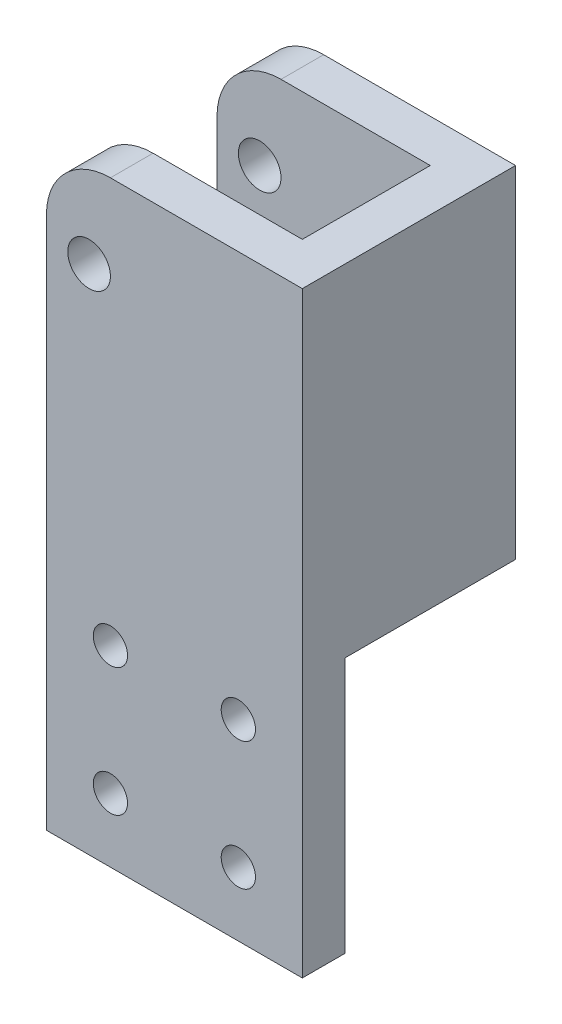
from build123d import *

# Parameters (mm, degrees)
SKETCH1_W                   = 38.1
SKETCH1_H                   = 76.2
BOSS_EXTRUDE1_DEPTH         = 31.75
SKETCH3_W                   = 25.4
SKETCH3_H                   = 76.2
CUT_EXTRUDE2_DEPTH          = 31.75
SKETCH4_W                   = 25.4
SKETCH4_H                   = 25.4
CUT_EXTRUDE3_DEPTH          = 89.44526556
SKETCH5_W                   = 31.75
SKETCH5_H                   = 6.35
BOSS_EXTRUDE2_DEPTH         = 50.8
SKETCH6_R                   = 3.175
CUT_EXTRUDE4_DEPTH          = 50.8
FILLET2_R                   = 9.525
SKETCH7_W                   = 31.75
SKETCH7_H                   = 19.05
BOSS_EXTRUDE3_DEPTH         = 6.35
SKETCH11_W                  = 38.1
SKETCH11_H                  = 6.35
BOSS_EXTRUDE4_DEPTH         = 12.7
F_1_4_20_TAPPED_HOLE2_D     = 5.1054
F_1_4_20_TAPPED_HOLE2_DEPTH = 16.51
F_1_4_20_TAPPED_HOLE2_TIP   = 1.533816902


with BuildPart() as part:
    # Sketch1 → Boss-Extrude1 (new body)
    with BuildSketch(Plane.XY):
        with Locations((19.05, 38.1)):
            Rectangle(SKETCH1_W, SKETCH1_H)
    extrude(amount=-BOSS_EXTRUDE1_DEPTH)

    # Sketch3 → Cut-Extrude2 (cut)
    with BuildSketch(Plane.ZY):
        with Locations((-19.05, 38.1)):
            Rectangle(SKETCH3_W, SKETCH3_H)
    extrude(amount=-CUT_EXTRUDE2_DEPTH, mode=Mode.SUBTRACT)

    # Sketch4 → Cut-Extrude3 (cut, through all)
    with BuildSketch(Plane.ZY.offset(-31.75)):
        with Locations((-19.05, 12.7)):
            Rectangle(SKETCH4_W, SKETCH4_H)
    extrude(amount=-CUT_EXTRUDE3_DEPTH, mode=Mode.SUBTRACT)

    # Sketch5 → Boss-Extrude2 (add)
    with BuildSketch(Plane(origin=(0, 76.2, 0), x_dir=(1, 0, 0), z_dir=(0, 1, 0))):
        with Locations((15.875, 28.575)):
            Rectangle(SKETCH5_W, SKETCH5_H)
    extrude(amount=-BOSS_EXTRUDE2_DEPTH)

    # Sketch6 → Cut-Extrude4 (cut)
    with BuildSketch(Plane(origin=(0, 0, -31.75), x_dir=(-1, 0, 0), z_dir=(0, 0, -1))):
        with Locations((-6.35, 63.5)):
            Circle(SKETCH6_R)
    extrude(amount=-CUT_EXTRUDE4_DEPTH, mode=Mode.SUBTRACT)

    # Fillet2
    fillet2_edges = [part.edges().sort_by_distance(p)[0] for p in [
        (0, 76.2, -3.175),
        (0, 76.2, -28.575),
    ]]
    fillet(fillet2_edges, radius=FILLET2_R)

    # Sketch7 → Boss-Extrude3 (add)
    with BuildSketch(Plane(origin=(0, 25.4, 0), x_dir=(-1, 0, 0), z_dir=(0, -1, 0))):
        with Locations((-15.875, 15.875)):
            Rectangle(SKETCH7_W, SKETCH7_H)
    extrude(amount=-BOSS_EXTRUDE3_DEPTH)

    # Sketch11 → Boss-Extrude4 (add)
    with BuildSketch(Plane.XZ):
        with Locations((19.05, -3.175)):
            Rectangle(SKETCH11_W, SKETCH11_H)
    extrude(amount=BOSS_EXTRUDE4_DEPTH)

    # 1/4-20 Tapped Hole2
    with Locations(Plane(origin=(9.525, -3.175, 0), x_dir=(1, 0, 0), z_dir=(0, 0, 1))):
        with Locations((0, 0), (19.05, 0), (0, 19.05), (19.05, 19.05)):
            Hole(F_1_4_20_TAPPED_HOLE2_D / 2, depth=F_1_4_20_TAPPED_HOLE2_DEPTH)
            with Locations((0, 0, -(F_1_4_20_TAPPED_HOLE2_DEPTH + F_1_4_20_TAPPED_HOLE2_TIP / 2))):  # 118° drill point
                Cone(0, F_1_4_20_TAPPED_HOLE2_D / 2, F_1_4_20_TAPPED_HOLE2_TIP, mode=Mode.SUBTRACT)


solid = part.part
